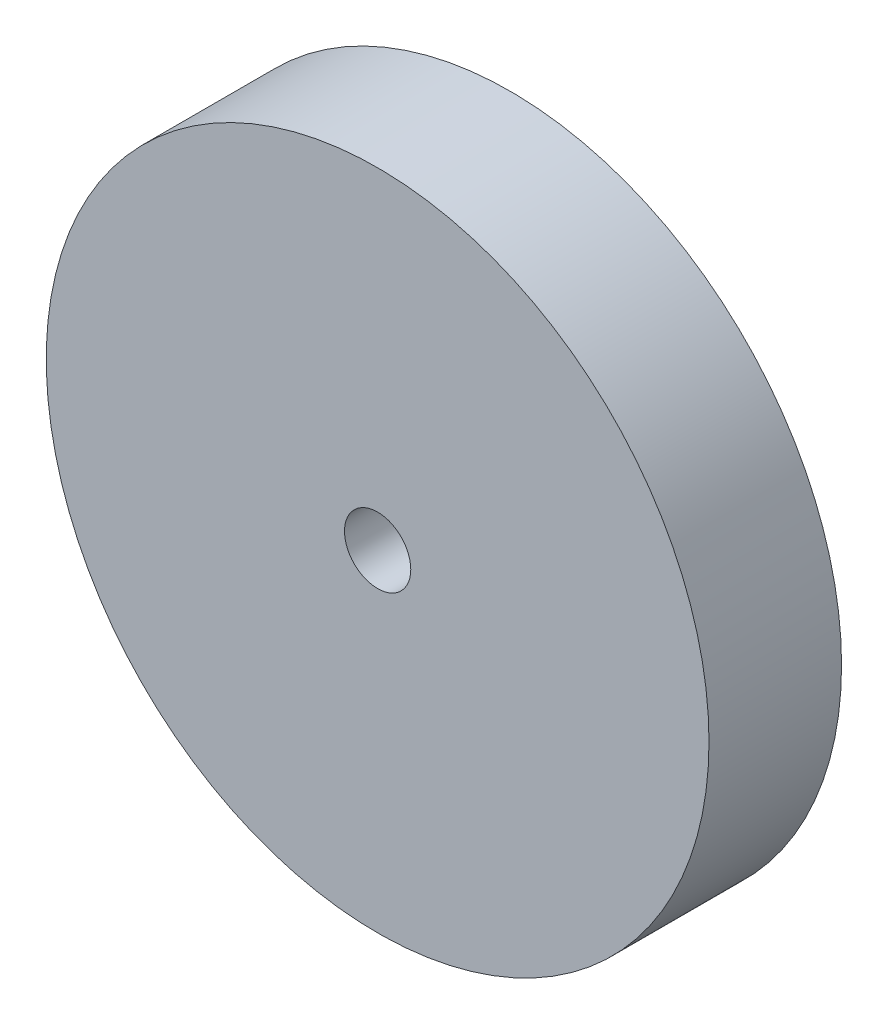
from build123d import *

# Parameters (mm, degrees)
SKETCH1_R           = 50
SKETCH1_R_2         = 5
BOSS_EXTRUDE1_DEPTH = 20


with BuildPart() as part:
    # Sketch1 → Boss-Extrude1 (new body)
    with BuildSketch(Plane.XY):
        with Locations((11.5, -184.674624292)):
            Circle(SKETCH1_R)
        with Locations((11.5, -184.674624292)):
            Circle(SKETCH1_R_2, mode=Mode.SUBTRACT)
    extrude(amount=-BOSS_EXTRUDE1_DEPTH)


solid = part.part
